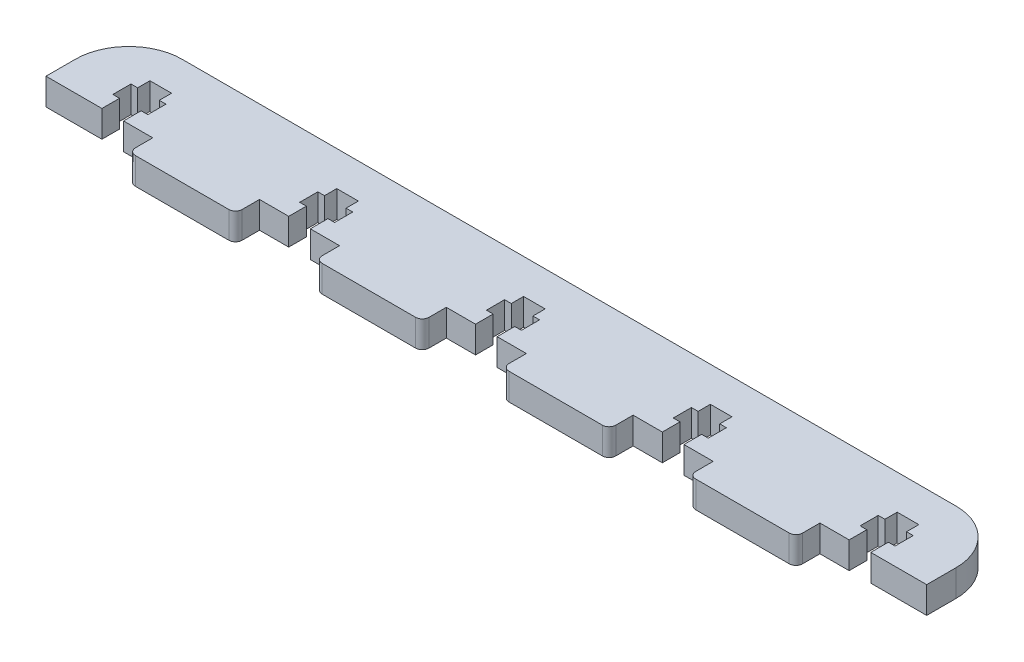
from build123d import *

# Parameters (mm, degrees)
SKETCH1_W                  = 330
SKETCH1_H                  = 40
BOSS_EXTRUDE1_DEPTH        = 10
SKETCH2_W                  = 10.95
SKETCH2_H                  = 9
SKETCH2_W_2                = 8.1
SKETCH2_H_2                = 6.6
SKETCH2_H_3                = 6.8
SKETCH2_W_3                = 2.5
SKETCH2_H_4                = 4.6
CUT_EXTRUDE1_DEPTH         = 167.508258053
FILLET1_R                  = 2.5
LPATTERN1_COUNT            = 3
LPATTERN1_PITCH            = 70
FILLET1_OF_LPATTERN1_R     = 2.5
LPATTERN1_COL_COUNT        = 3
LPATTERN1_COL_PITCH        = 70
FILLET1_OF_LPATTERN1_COL_R = 2.5
SKETCH3_W                  = 10
SKETCH3_H                  = 9
CUT_EXTRUDE2_DEPTH         = 167.508258053
FILLET2_R                  = 20


with BuildPart() as part:
    # Sketch1 → Boss-Extrude1 (new body)
    with BuildSketch(Plane(origin=(0, 0, 0), x_dir=(1, 0, 0), z_dir=(0, 1, 0))):
        Rectangle(SKETCH1_W, SKETCH1_H)
    extrude(amount=BOSS_EXTRUDE1_DEPTH)

    # Sketch2 → Cut-Extrude1 (cut, through all)
    with BuildSketch(Plane(origin=(0, 10, 0), x_dir=(1, 0, 0), z_dir=(0, 1, 0))):
        with Locations((9.525, -15.5)):
            Rectangle(SKETCH2_W, SKETCH2_H)
        with Locations((0, -15.5)):
            Rectangle(SKETCH2_W_2, SKETCH2_H)
        with Locations((-9.525, -15.5)):
            Rectangle(SKETCH2_W, SKETCH2_H)
        with Locations((0, -7.7)):
            Rectangle(SKETCH2_W_2, SKETCH2_H_2)
        with Locations((0, -1)):
            Rectangle(SKETCH2_W_2, SKETCH2_H_3)
        with Locations((-5.3, -1)):
            Rectangle(SKETCH2_W_3, SKETCH2_H_3)
        with Locations((0, 4.7)):
            Rectangle(SKETCH2_W_2, SKETCH2_H_4)
        with Locations((5.3, -1)):
            Rectangle(SKETCH2_W_3, SKETCH2_H_3)
    cut_extrude1 = extrude(amount=-CUT_EXTRUDE1_DEPTH, mode=Mode.SUBTRACT)

    # Fillet1
    fillet1_edges = [part.edges().sort_by_distance(p)[0] for p in [
        (15, 5, 20),
        (-15, 5, 20),
    ]]
    fillet(fillet1_edges, radius=FILLET1_R)

    # LPattern1: Cut-Extrude1 ×3
    with Locations(*[(i * LPATTERN1_PITCH, 0, 0) for i in range(1, LPATTERN1_COUNT)]):
        add(cut_extrude1, mode=Mode.SUBTRACT)

    # Fillet1 of LPattern1
    fillet1_of_lpattern1_edges = [part.edges().sort_by_distance(p)[0] for p in [
        (85, 5, 20),
        (55, 5, 20),
        (155, 5, 20),
        (125, 5, 20),
    ]]
    fillet(fillet1_of_lpattern1_edges, radius=FILLET1_OF_LPATTERN1_R)

    # LPattern1 col: Cut-Extrude1 ×3
    with Locations(*[(-i * LPATTERN1_COL_PITCH, 0, 0) for i in range(1, LPATTERN1_COL_COUNT)]):
        add(cut_extrude1, mode=Mode.SUBTRACT)

    # Fillet1 of LPattern1 col
    fillet1_of_lpattern1_col_edges = [part.edges().sort_by_distance(p)[0] for p in [
        (-55, 5, 20),
        (-85, 5, 20),
        (-125, 5, 20),
        (-155, 5, 20),
    ]]
    fillet(fillet1_of_lpattern1_col_edges, radius=FILLET1_OF_LPATTERN1_COL_R)

    # Sketch3 → Cut-Extrude2 (cut, through all)
    with BuildSketch(Plane(origin=(0, 10, 0), x_dir=(1, 0, 0), z_dir=(0, 1, 0))):
        with Locations((-160, -15.5)):
            Rectangle(SKETCH3_W, SKETCH3_H)
    cut_extrude2 = extrude(amount=-CUT_EXTRUDE2_DEPTH, mode=Mode.SUBTRACT)

    # Mirror1: Cut-Extrude2 across plane
    add(cut_extrude2.mirror(Plane(origin=(0, 0, 0), x_dir=(0, 0, 1), z_dir=(1, 0, 0))), mode=Mode.SUBTRACT)

    # Fillet2
    fillet2_edges = [part.edges().sort_by_distance(p)[0] for p in [
        (-165, 5, -20),
        (165, 5, -20),
    ]]
    fillet(fillet2_edges, radius=FILLET2_R)


solid = part.part
